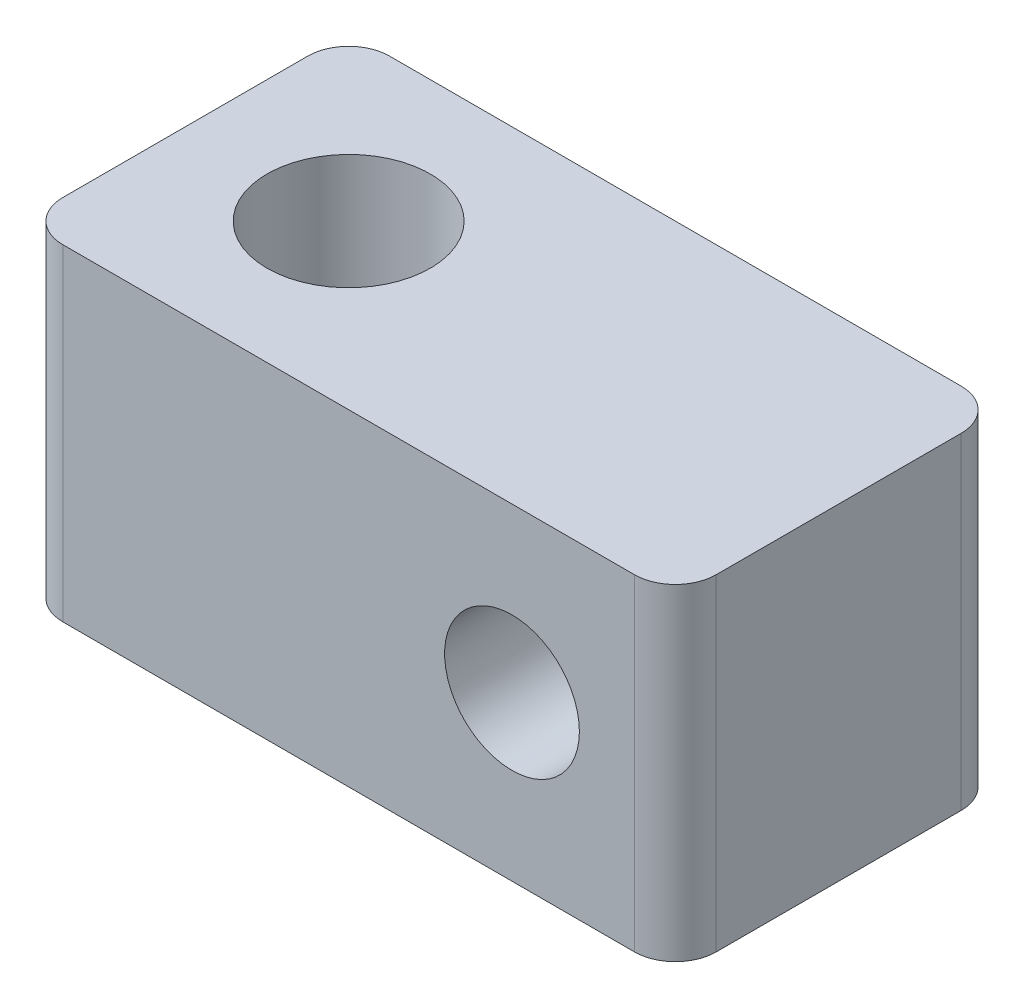
from build123d import *

# Parameters (mm, degrees)
SKETCH_1_W             = 16
SKETCH_1_H             = 8
EXTRUDE_1_DEPTH        = 8
HOLE_WIZARD_M4_2_D     = 3.3
HOLE_WIZARD_M4_2_DEPTH = 11.6
HOLE_WIZARD_M4_2_TIP   = 0.991420021
FILLET_1_R             = 1
SKETCH_7_R             = 2
CUT_EXTRUDE_1_DEPTH    = 10


with BuildPart() as part:
    # 草图1 → 凸台-拉伸1 (new body)
    with BuildSketch(Plane(origin=(0, 0, 0), x_dir=(1, 0, 0), z_dir=(0, 1, 0))):
        Rectangle(SKETCH_1_W, SKETCH_1_H)
    extrude(amount=EXTRUDE_1_DEPTH)

    # M4 螺纹孔2
    with Locations(Plane.XY.offset(4)):
        with Locations((4, 4)):
            Hole(HOLE_WIZARD_M4_2_D / 2, depth=HOLE_WIZARD_M4_2_DEPTH)
            with Locations((0, 0, -(HOLE_WIZARD_M4_2_DEPTH + HOLE_WIZARD_M4_2_TIP / 2))):  # 118° drill point
                Cone(0, HOLE_WIZARD_M4_2_D / 2, HOLE_WIZARD_M4_2_TIP, mode=Mode.SUBTRACT)

    # 圆角1
    fillet_1_edges = [part.edges().sort_by_distance(p)[0] for p in [
        (8, 4, 4),
        (-8, 4, 4),
        (-8, 4, -4),
        (8, 4, -4),
    ]]
    fillet(fillet_1_edges, radius=FILLET_1_R)

    # 草图7 → 切除-拉伸1 (cut)
    with BuildSketch(Plane(origin=(0, 8, 0), x_dir=(1, 0, 0), z_dir=(0, 1, 0))):
        with Locations(Location((-4, 0, 0), (0, 0, 270))):
            Circle(SKETCH_7_R)
    extrude(amount=-CUT_EXTRUDE_1_DEPTH, mode=Mode.SUBTRACT)


solid = part.part
